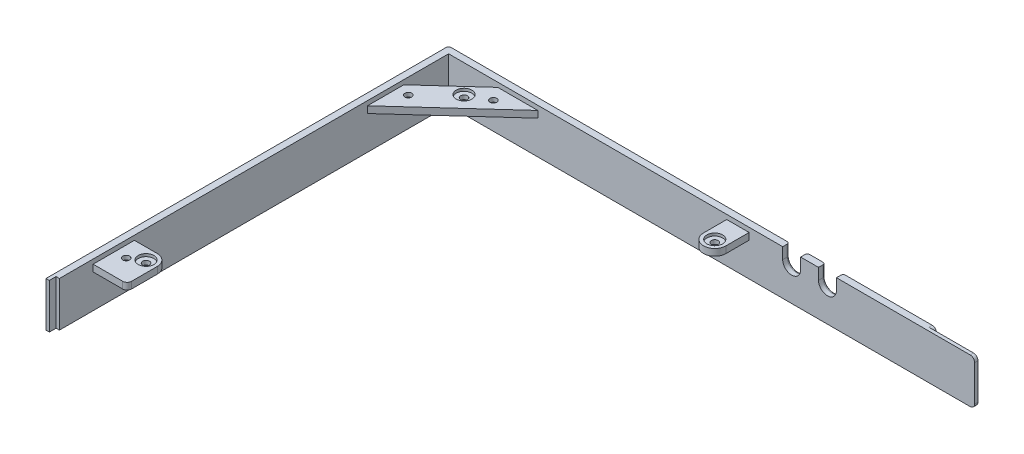
from build123d import *

# Parameters (mm, degrees)
EXTRUDE_1_DEPTH     = 20
EXTRUDE_START       = 1
SKETCH_2_R          = 1.525
EXTRUDE_2_DEPTH     = 3
CUT_EXTRUDE_1_REACH = 358.708
SKETCH_3_W          = 31
SKETCH_3_H          = 9.5
SKETCH_4_R          = 3.5
CUT_EXTRUDE_2_DEPTH = 1.2
CUT_EXTRUDE_3_REACH = 356.959
SKETCH_5_R          = 1.525
FILLET_1_R          = 1
FILLET_3_R          = 1
SKETCH_6_R          = 3.5
CUT_EXTRUDE_4_DEPTH = 1.2
SKETCH_7_W          = 69.4
SKETCH_7_H          = 20
CUT_EXTRUDE_5_DEPTH = 3
SKETCH_8_W          = 20
SKETCH_8_H          = 20
CUT_EXTRUDE_6_DEPTH = 1.5
FILLET_4_R          = 2
FILLET_5_R          = 2
FILLET_6_R          = 2
CUT_EXTRUDE_7_DEPTH = 10
FILLET_7_R          = 1
FILLET_8_R          = 1


with BuildPart() as part:
    # 草图1 → 凸台-拉伸1 (new body)
    with BuildSketch(Plane(origin=(0, 0, 0), x_dir=(1, 0, 0), z_dir=(0, 1, 0))):
        Polygon((1.5, 0), (3, 0), (3, 173.85), (307.4, 173.85), (307.4, 176.85), (0, 176.85), (0, 0), (0, -3), (1.5, -3), align=None)
    extrude(amount=EXTRUDE_1_DEPTH)

    # 草图2 → 凸台-拉伸2 (add)
    # profile 1 of 3: a face of its own
    with BuildSketch(Plane(origin=(0, 14, 0), x_dir=(1, 0, 0), z_dir=(0, 1, 0)).offset(EXTRUDE_START)):
        Polygon((3, 153.85), (25, 173.85), (42.839282497, 173.85), (3, 137.632470457), align=None)
        with Locations(Location((20.25, 163.5, 0), (0, 0, 270))):
            Circle(SKETCH_2_R, mode=Mode.SUBTRACT)
    # profile 2 of 3: a face of its own
    with BuildSketch(Plane(origin=(0, 14, 0), x_dir=(1, 0, 0), z_dir=(0, 1, 0)).offset(EXTRUDE_START)):
        with BuildLine():
            Line((137.25, 163.5), (137.25, 173.85))
            Line((137.25, 173.85), (127.25, 173.85))
            Line((127.25, 173.85), (127.25, 163.5))
            ThreePointArc((127.25, 163.5), (132.25, 158.5), (137.25, 163.5))
        make_face()
        with Locations(Location((132.25, 163.5, 0), (0, 0, 270))):
            Circle(SKETCH_2_R, mode=Mode.SUBTRACT)
    # profile 3 of 3: a face of its own
    with BuildSketch(Plane(origin=(0, 14, 0), x_dir=(1, 0, 0), z_dir=(0, 1, 0)).offset(EXTRUDE_START)):
        with BuildLine():
            Line((3, 23.870342351), (3, 33.5))
            Line((3, 33.5), (13.2, 33.5))
            ThreePointArc((13.2, 33.5), (16.735533906, 32.035533906), (18.2, 28.5))
            Line((18.2, 28.5), (18.2, 15.043961292))
            Line((18.2, 15.043961292), (3, 15.043961292))
            Line((3, 15.043961292), (3, 23.870342351))
        make_face()
        with Locations(Location((13.2, 28.5, 0), (0, 0, 270))):
            Circle(SKETCH_2_R, mode=Mode.SUBTRACT)
    extrude(amount=EXTRUDE_2_DEPTH)

    # 草图3 → 切除-拉伸1 (cut, up to next)
    with BuildSketch(Plane(origin=(0, 0, -176.85), x_dir=(-1, 0, 0), z_dir=(0, 0, -1)), mode=Mode.PRIVATE) as cut_extrude_1_sk1:
        with Locations((-291.9, 15.25)):
            Rectangle(SKETCH_3_W, SKETCH_3_H)
    cut_extrude_1_tool1 = extrude(cut_extrude_1_sk1.sketch, amount=-CUT_EXTRUDE_1_REACH, mode=Mode.PRIVATE) & part.part
    add(cut_extrude_1_tool1.solids().sort_by_distance((291.9, 15.25, -176.85))[0], mode=Mode.SUBTRACT)

    # 草图4 → 切除-拉伸2 (cut)
    with BuildSketch(Plane(origin=(0, 18, 0), x_dir=(1, 0, 0), z_dir=(0, 1, 0))):
        with Locations(Location((13.2, 28.5, 0), (0, 0, 270))):
            Circle(SKETCH_4_R)
        with Locations(Location((20.25, 163.5, 0), (0, 0, 270))):
            Circle(SKETCH_4_R)
        with Locations(Location((132.25, 163.5, 0), (0, 0, 270))):
            Circle(SKETCH_4_R)
    extrude(amount=-CUT_EXTRUDE_2_DEPTH, mode=Mode.SUBTRACT)

    # 草图5 → 切除-拉伸3 (cut, up to next)
    with BuildSketch(Plane.XZ.offset(-15), mode=Mode.PRIVATE) as cut_extrude_3_sk1:
        with Locations(Location((29, -167.85, 0), (0, 0, 270))):
            Circle(SKETCH_5_R)
    cut_extrude_3_tool1 = extrude(cut_extrude_3_sk1.sketch, amount=-CUT_EXTRUDE_3_REACH, mode=Mode.PRIVATE) & part.part
    # 草图5 → 切除-拉伸3 (cut, up to next)
    with BuildSketch(Plane.XZ.offset(-15), mode=Mode.PRIVATE) as cut_extrude_3_sk2:
        with Locations(Location((8, -150.85, 0), (0, 0, 270))):
            Circle(SKETCH_5_R)
    cut_extrude_3_tool2 = extrude(cut_extrude_3_sk2.sketch, amount=-CUT_EXTRUDE_3_REACH, mode=Mode.PRIVATE) & part.part
    # 草图5 → 切除-拉伸3 (cut, up to next)
    with BuildSketch(Plane.XZ.offset(-15), mode=Mode.PRIVATE) as cut_extrude_3_sk3:
        with Locations(Location((8, -24.8, 0), (0, 0, 270))):
            Circle(SKETCH_5_R)
    cut_extrude_3_tool3 = extrude(cut_extrude_3_sk3.sketch, amount=-CUT_EXTRUDE_3_REACH, mode=Mode.PRIVATE) & part.part
    add(cut_extrude_3_tool1.solids().sort_by_distance((29, 15, -167.85))[0], mode=Mode.SUBTRACT)
    add(cut_extrude_3_tool2.solids().sort_by_distance((8, 15, -150.85))[0], mode=Mode.SUBTRACT)
    add(cut_extrude_3_tool3.solids().sort_by_distance((8, 15, -24.8))[0], mode=Mode.SUBTRACT)

    # 圆角1
    fillet_1_edges = [part.edges().sort_by_distance(p)[0] for p in [
        (0, 10, -176.85),
    ]]
    fillet(fillet_1_edges, radius=FILLET_1_R)

    # 圆角3
    fillet_3_edges = [part.edges().sort_by_distance(p)[0] for p in [
        (276.4, 10.5, -175.35),
    ]]
    fillet(fillet_3_edges, radius=FILLET_3_R)

    # 草图6 → 切除-拉伸4 (cut)
    with BuildSketch(Plane.XZ.offset(-15)):
        with Locations(Location((8, -24.8, 0), (0, 0, 270))):
            Circle(SKETCH_6_R)
        with Locations(Location((8, -150.85, 0), (0, 0, 270))):
            Circle(SKETCH_6_R)
        with Locations(Location((29, -167.85, 0), (0, 0, 270))):
            Circle(SKETCH_6_R)
    extrude(amount=-CUT_EXTRUDE_4_DEPTH, mode=Mode.SUBTRACT)

    # 草图7 → 切除-拉伸5 (cut)
    with BuildSketch(Plane(origin=(0, 0, -176.85), x_dir=(-1, 0, 0), z_dir=(0, 0, -1))):
        with Locations((-272.7, 10)):
            Rectangle(SKETCH_7_W, SKETCH_7_H)
    extrude(amount=-CUT_EXTRUDE_5_DEPTH, mode=Mode.SUBTRACT)

    # 草图8 → 切除-拉伸6 (cut)
    with BuildSketch(Plane(origin=(0, 0, -176.85), x_dir=(-1, 0, 0), z_dir=(0, 0, -1))):
        with Locations((-228, 10)):
            Rectangle(SKETCH_8_W, SKETCH_8_H)
    extrude(amount=-CUT_EXTRUDE_6_DEPTH, mode=Mode.SUBTRACT)

    # 圆角4
    fillet_4_edges = [part.edges().sort_by_distance(p)[0] for p in [
        (218, 20, -176.1),
        (218, 0, -176.1),
    ]]
    fillet(fillet_4_edges, radius=FILLET_4_R)

    # 圆角5
    fillet_5_edges = [part.edges().sort_by_distance(p)[0] for p in [
        (238, 20, -174.6),
        (238, 0, -174.6),
    ]]
    fillet(fillet_5_edges, radius=FILLET_5_R)

    # 圆角6
    fillet_6_edges = [part.edges().sort_by_distance(p)[0] for p in [
        (18.2, 16.5, -15.043961292),
    ]]
    fillet(fillet_6_edges, radius=FILLET_6_R)

    # 草图9 → 切除-拉伸7 (cut)
    with BuildSketch(Plane.XY.offset(-173.85)):
        with BuildLine():
            Line((152.25, 15), (152.25, 20))
            Line((152.25, 20), (160.25, 20))
            Line((160.25, 20), (160.25, 15))
            ThreePointArc((160.25, 15), (156.25, 11), (152.25, 15))
        make_face()
        with BuildLine():
            Line((168.25, 15), (168.25, 20))
            Line((168.25, 20), (176.25, 20))
            Line((176.25, 20), (176.25, 15))
            ThreePointArc((176.25, 15), (172.25, 11), (168.25, 15))
        make_face()
    extrude(amount=-CUT_EXTRUDE_7_DEPTH, mode=Mode.SUBTRACT)

    # 圆角7
    fillet_7_edges = [part.edges().sort_by_distance(p)[0] for p in [
        (156.25, 11, -176.85),
        (152.25, 17.5, -176.85),
        (160.25, 17.5, -176.85),
    ]]
    fillet(fillet_7_edges, radius=FILLET_7_R)

    # 圆角8
    fillet_8_edges = [part.edges().sort_by_distance(p)[0] for p in [
        (172.25, 11, -176.85),
        (168.25, 17.5, -176.85),
        (176.25, 17.5, -176.85),
    ]]
    fillet(fillet_8_edges, radius=FILLET_8_R)


solid = part.part
